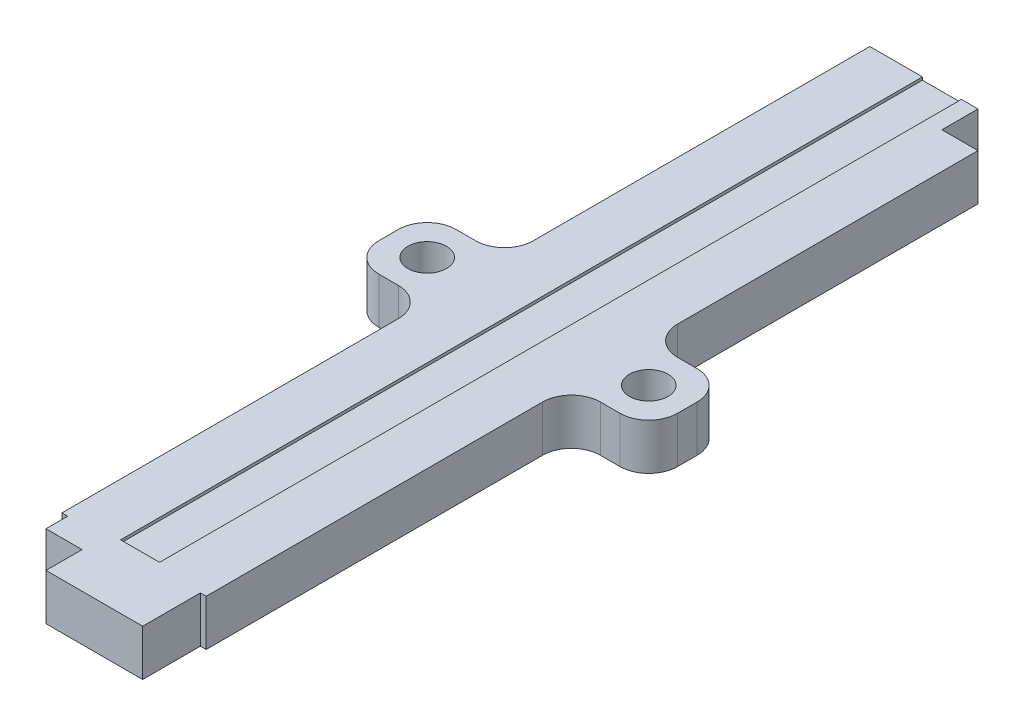
from build123d import *

# Parameters (mm, degrees)
SKETCH1_W               = 12.7
SKETCH1_H               = 4.064
BOSS_EXTRUDE1_DEPTH     = 228.6
SKETCH2_W               = 3.429
SKETCH2_H               = 217.3732
CUT_EXTRUDE1_DEPTH      = 0.254
SKETCH3_W               = 0.508
SKETCH3_H               = 5.08
CUT_EXTRUDE2_DEPTH      = 229.724285103
MIRROR2_COPY_1_SKETCH_W = 0.508
MIRROR2_COPY_1_SKETCH_H = 5.08
MIRROR2_COPY_1_DEPTH    = 229.724285103
SKETCH4_W               = 3.175
SKETCH4_H               = 3.175
CUT_EXTRUDE3_DEPTH      = 229.724285103
CUT_EXTRUDE4_DEPTH      = 229.724285103
SKETCH7_W               = 6.80212
SKETCH7_H               = 6.80212
SKETCH7_R               = 1.70053
BOSS_EXTRUDE2_DEPTH     = 4.064
FILLET1_R               = 2.54


with BuildPart() as part:
    # Sketch1 → Boss-Extrude1 (new body)
    with BuildSketch(Plane.XY):
        Rectangle(SKETCH1_W, SKETCH1_H)
    extrude(amount=BOSS_EXTRUDE1_DEPTH)

    # Sketch2 → Cut-Extrude1 (cut)
    with BuildSketch(Plane(origin=(0, 2.032, 0), x_dir=(1, 0, 0), z_dir=(0, 1, 0))):
        with Locations((0, -114.3)):
            Rectangle(SKETCH2_W, SKETCH2_H)
    extrude(amount=-CUT_EXTRUDE1_DEPTH, mode=Mode.SUBTRACT)

    # Sketch3 → Cut-Extrude2 (cut, through all)
    with BuildSketch(Plane(origin=(0, 2.032, 0), x_dir=(1, 0, 0), z_dir=(0, 1, 0))):
        with Locations((-6.096, -226.06)):
            Rectangle(SKETCH3_W, SKETCH3_H)
    cut_extrude2 = extrude(amount=-CUT_EXTRUDE2_DEPTH, mode=Mode.SUBTRACT)

    # Mirror1: Cut-Extrude2 across plane
    add(cut_extrude2.mirror(Plane(origin=(0, 0, 114.3), x_dir=(1, 0, 0), z_dir=(0, 0, -1))), mode=Mode.SUBTRACT)

    # Mirror2: Cut-Extrude2 across plane
    add(cut_extrude2.mirror(Plane(origin=(0, 0, 0), x_dir=(0, 0, 1), z_dir=(1, 0, 0))), mode=Mode.SUBTRACT)

    # Mirror2 copy 1 sketch → Mirror2 copy 1 (cut, through all)
    with BuildSketch(Plane(origin=(0, 2.032, 228.6), x_dir=(-1, 0, 0), z_dir=(0, 1, 0))):
        with Locations((-6.096, -226.06)):
            Rectangle(MIRROR2_COPY_1_SKETCH_W, MIRROR2_COPY_1_SKETCH_H)
    extrude(amount=-MIRROR2_COPY_1_DEPTH, mode=Mode.SUBTRACT)

    # Sketch4 → Cut-Extrude3 (cut, through all)
    with BuildSketch(Plane(origin=(0, 2.032, 0), x_dir=(1, 0, 0), z_dir=(0, 1, 0))):
        with Locations((-4.2545, -227.0125)):
            Rectangle(SKETCH4_W, SKETCH4_H)
    extrude(amount=-CUT_EXTRUDE3_DEPTH, mode=Mode.SUBTRACT)

    # Sketch5 → Cut-Extrude4 (cut, through all)
    with BuildSketch(Plane(origin=(0, 2.032, 0), x_dir=(1, 0, 0), z_dir=(0, 1, 0))):
        Polygon((-6.35, 0), (6.35, 0), (6.35, -152.4), (6.35, -155.575), (3.175, -155.575), (3.175, -152.4), (-6.35, -152.4), align=None)
    extrude(amount=-CUT_EXTRUDE4_DEPTH, mode=Mode.SUBTRACT)

    # Sketch7 → Boss-Extrude2 (add, through all)
    # profile 1 of 2: a face of its own
    with BuildSketch(Plane(origin=(0, 2.032, 0), x_dir=(1, 0, 0), z_dir=(0, 1, 0))):
        with Locations((9.75106, -187.96)):
            Rectangle(SKETCH7_W, SKETCH7_H)
        with Locations(Location((9.75106, -187.96, 0), (0, 0, 270))):
            Circle(SKETCH7_R, mode=Mode.SUBTRACT)
    # profile 2 of 2: a face of its own
    with BuildSketch(Plane(origin=(0, 2.032, 0), x_dir=(1, 0, 0), z_dir=(0, 1, 0))):
        with Locations((-9.75106, -187.96)):
            Rectangle(SKETCH7_W, SKETCH7_H)
        with Locations(Location((-9.75106, -187.96, 0), (0, 0, 270))):
            Circle(SKETCH7_R, mode=Mode.SUBTRACT)
    extrude(amount=-BOSS_EXTRUDE2_DEPTH)

    # Fillet1
    fillet1_edges = [part.edges().sort_by_distance(p)[0] for p in [
        (6.35, 0, 191.36106),
        (13.15212, 0, 191.36106),
        (13.15212, 0, 184.55894),
        (6.35, 0, 184.55894),
        (-13.15212, 0, 184.55894),
        (-6.35, 0, 184.55894),
        (-13.15212, 0, 191.36106),
        (-6.35, 0, 191.36106),
    ]]
    fillet(fillet1_edges, radius=FILLET1_R)


solid = part.part
